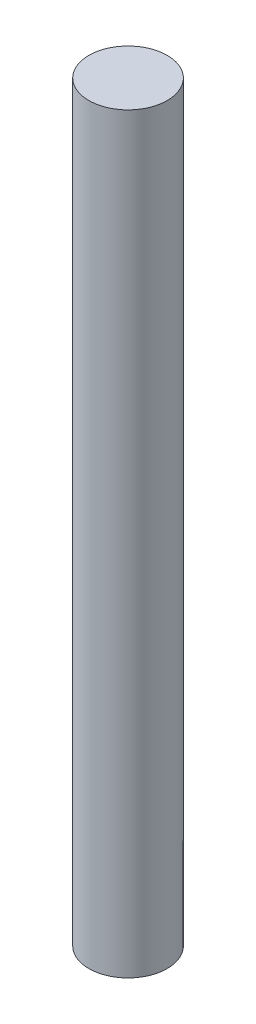
from build123d import *

# Parameters (mm, degrees)
SKETCH1_R           = 1.5875
BOSS_EXTRUDE1_DEPTH = 30.48


with BuildPart() as part:
    # Sketch1 → Boss-Extrude1 (new body)
    with BuildSketch(Plane(origin=(0, 0, 0), x_dir=(1, 0, 0), z_dir=(0, 1, 0))):
        with Locations(Location((0, 0, 0), (0, 0, 90))):
            Circle(SKETCH1_R)
    extrude(amount=BOSS_EXTRUDE1_DEPTH)


solid = part.part
